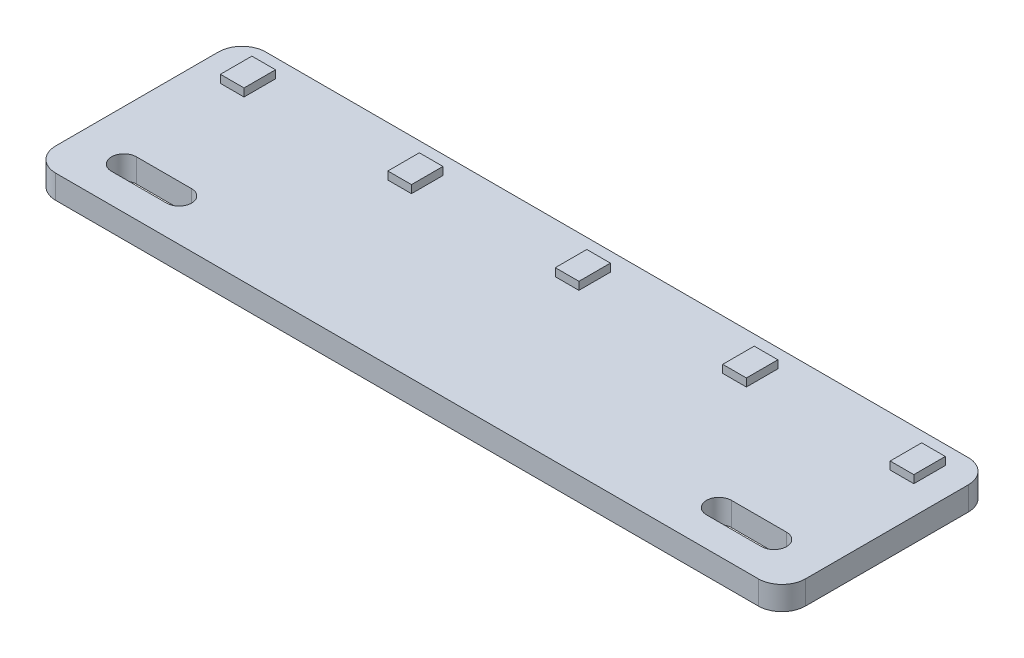
from build123d import *

# Parameters (mm, degrees)
SKETCH_1_W                 = 95.25
SKETCH_1_H                 = 26.67
EXTRUDE_1_DEPTH            = 1.5
FILLET_1_R                 = 3
SKETCH_2_W                 = 3
SKETCH_2_H                 = 4
EXTRUDE_2_DEPTH            = 2.5
PATTERN_LINEAR_1_COUNT     = 3
PATTERN_LINEAR_1_PITCH     = 21.27
PATTERN_LINEAR_1_COL_COUNT = 3
PATTERN_LINEAR_1_COL_PITCH = 21.27


with BuildPart() as part:
    # 草图1 → 凸台-拉伸1 (new, symmetric)
    with BuildSketch(Plane(origin=(0, 0, 0), x_dir=(1, 0, 0), z_dir=(0, 1, 0))):
        Rectangle(SKETCH_1_W, SKETCH_1_H)
        with BuildLine():
            Line((34.29, -6.41), (41.29, -6.41))
            ThreePointArc((41.29, -6.41), (42.88, -8), (41.29, -9.59))
            Line((41.29, -9.59), (34.29, -9.59))
            ThreePointArc((34.29, -9.59), (32.7, -8), (34.29, -6.41))
        make_face(mode=Mode.SUBTRACT)
        with BuildLine():
            Line((-34.29, -6.41), (-41.29, -6.41))
            ThreePointArc((-41.29, -6.41), (-42.88, -8), (-41.29, -9.59))
            Line((-41.29, -9.59), (-34.29, -9.59))
            ThreePointArc((-34.29, -9.59), (-32.7, -8), (-34.29, -6.41))
        make_face(mode=Mode.SUBTRACT)
    extrude(amount=EXTRUDE_1_DEPTH, both=True)

    # 圆角1
    fillet_1_edges = [part.edges().sort_by_distance(p)[0] for p in [
        (47.625, 0, 13.335),
        (-47.625, 0, 13.335),
        (-47.625, 0, -13.335),
        (47.625, 0, -13.335),
    ]]
    fillet(fillet_1_edges, radius=FILLET_1_R)

    # 草图2 → 凸台-拉伸2 (add, symmetric)
    with BuildSketch(Plane(origin=(0, 0, 0), x_dir=(1, 0, 0), z_dir=(0, 1, 0))):
        with Locations((0, 9)):
            Rectangle(SKETCH_2_W, SKETCH_2_H)
    extrude_2 = extrude(amount=EXTRUDE_2_DEPTH, both=True)

    # 阵列(线性)1: 凸台-拉伸2 ×3
    with Locations(*[(i * PATTERN_LINEAR_1_PITCH, 0, 0) for i in range(1, PATTERN_LINEAR_1_COUNT)]):
        add(extrude_2)

    # 阵列(线性)1 col: 凸台-拉伸2 ×3
    with Locations(*[(-i * PATTERN_LINEAR_1_COL_PITCH, 0, 0) for i in range(1, PATTERN_LINEAR_1_COL_COUNT)]):
        add(extrude_2)


solid = part.part
